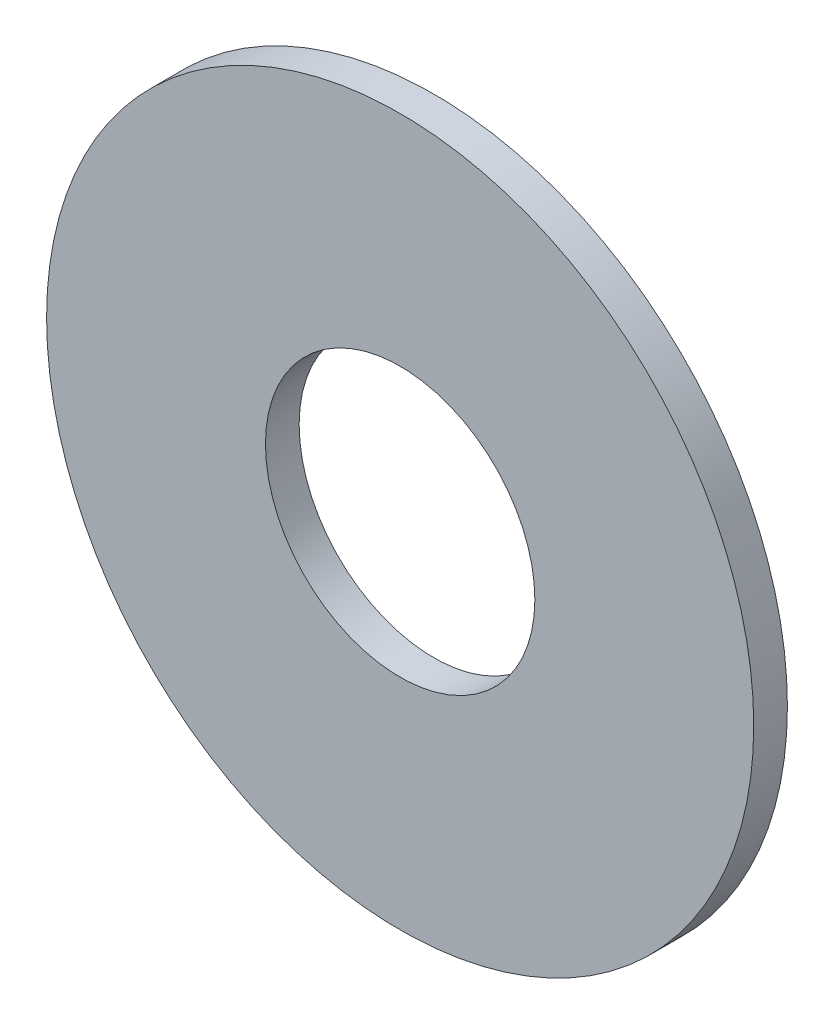
from build123d import *

# Parameters (mm, degrees)
CROQUIS1_R              = 21
CROQUIS1_R_2            = 8
SALIENTE_EXTRUIR1_DEPTH = 2


with BuildPart() as part:
    # Croquis1 → Saliente-Extruir1 (new body)
    with BuildSketch(Plane.XY):
        Circle(CROQUIS1_R)
        Circle(CROQUIS1_R_2, mode=Mode.SUBTRACT)
    extrude(amount=SALIENTE_EXTRUIR1_DEPTH)


solid = part.part
